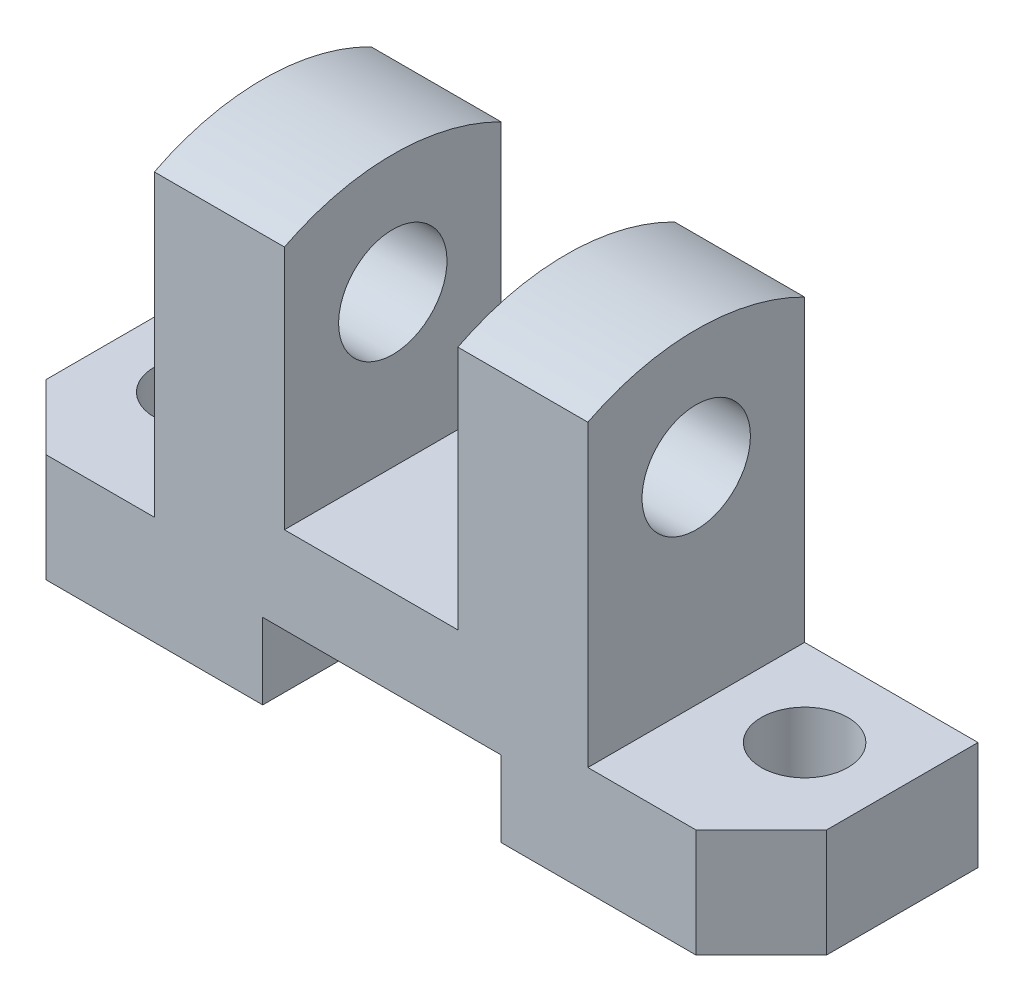
from build123d import *

# Parameters (mm, degrees)
BOSS_EXTRU_1_DEPTH                = 57.15
ESQUISSE2_W                       = 25.4
ESQUISSE2_H                       = 47.625
ESQUISSE2_H_2                     = 39.6875
ESQUISSE2_W_2                     = 34.925
ESQUISSE2_H_3                     = 11.1125
ENL_V_MAT_EXTRU_1_DEPTH           = 92.139645599
CHANFREIN1_SIZE                   = 9.525
DIAM_TRE_DU_PER_AGE_5_8_0_625_2_D = 15.875
DIAM_TRE_DU_PER_AGE_1_2_0_5_1_D   = 12.7


with BuildPart() as part:
    # Esquisse1 → Boss.-Extru.1 (new, symmetric)
    with BuildSketch(Plane(origin=(0, 0, 0), x_dir=(0, 0, -1), z_dir=(1, 0, 0))):
        with BuildLine():
            Line((-15.875, 59.683519733), (-15.875, 0))
            Line((-15.875, 0), (15.875, 0))
            Line((15.875, 0), (15.875, 59.683519733))
            ThreePointArc((15.875, 59.683519733), (0, 63.5), (-15.875, 59.683519733))
        make_face()
    extrude(amount=BOSS_EXTRU_1_DEPTH, both=True)

    # Esquisse2 → Enlèv. mat.-Extru.1 (cut, through all)
    with BuildSketch(Plane.XY.offset(15.875)):
        with Locations((44.45, 39.6875)):
            Rectangle(ESQUISSE2_W, ESQUISSE2_H)
        with Locations((-44.45, 39.6875)):
            Rectangle(ESQUISSE2_W, ESQUISSE2_H)
        with Locations((0, 43.65625)):
            Rectangle(ESQUISSE2_W, ESQUISSE2_H_2)
        with Locations((1.5875, 5.55625)):
            Rectangle(ESQUISSE2_W_2, ESQUISSE2_H_3)
    extrude(amount=-ENL_V_MAT_EXTRU_1_DEPTH, mode=Mode.SUBTRACT)

    # Chanfrein1
    chanfrein1_edges = [part.edges().sort_by_distance(p)[0] for p in [
        (-57.15, 7.9375, 15.875),
        (57.15, 7.9375, 15.875),
    ]]
    chamfer(chanfrein1_edges, length=CHANFREIN1_SIZE)

    # Diamètre du perçage 5/8 (0.625)2 (through all)
    with Locations(Plane(origin=(31.75, 0, 0), x_dir=(0, 0, -1), z_dir=(1, 0, 0))):
        with Locations((0, 46.0375)):
            Hole(DIAM_TRE_DU_PER_AGE_5_8_0_625_2_D / 2)

    # Diamètre du perçage 1/2 (0.5)1 (through all)
    with Locations(Plane(origin=(0, 15.875, 0), x_dir=(1, 0, 0), z_dir=(0, 1, 0))):
        with Locations((44.45, 3.175)):
            diam_tre_du_per_age_1_2_0_5_1 = Hole(DIAM_TRE_DU_PER_AGE_1_2_0_5_1_D / 2)

    # Symétrie1: Diamètre du perçage 1/2 (0.5)1 across plane
    add(diam_tre_du_per_age_1_2_0_5_1.mirror(Plane(origin=(0, 0, 0), x_dir=(0, 0, 1), z_dir=(1, 0, 0))), mode=Mode.SUBTRACT)


solid = part.part
